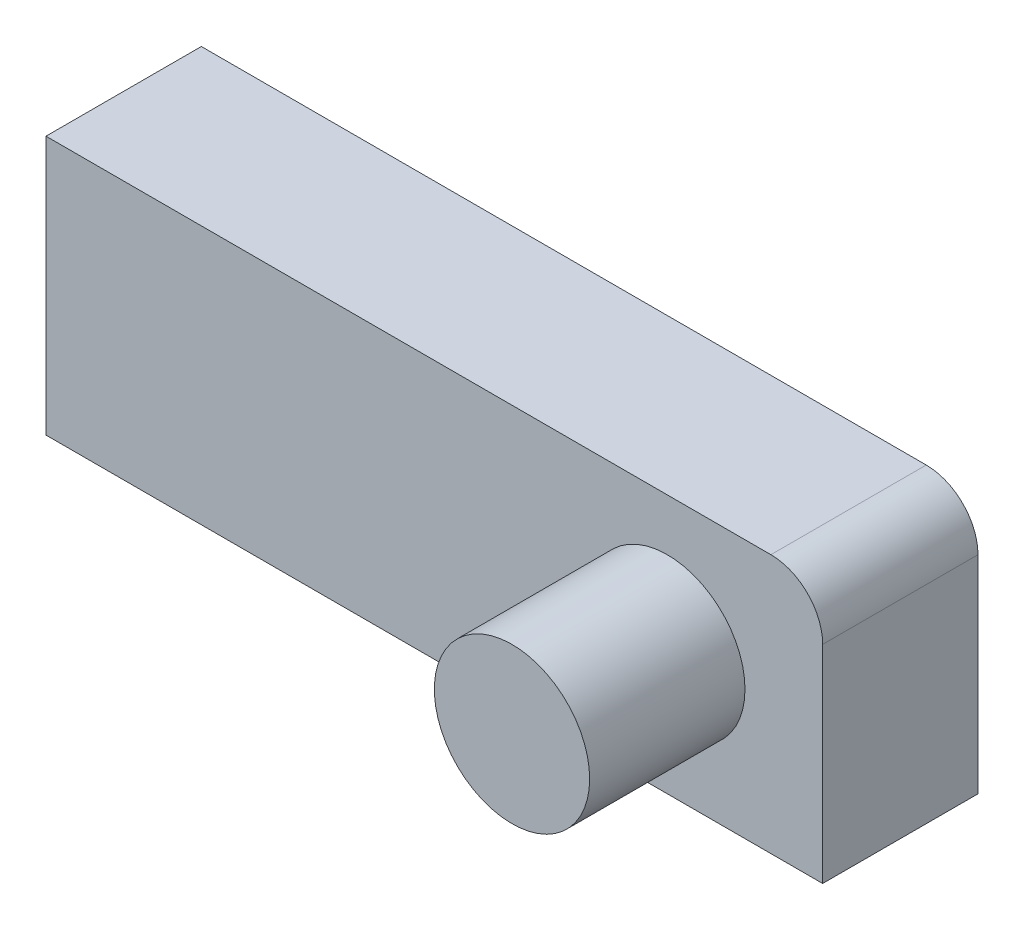
from build123d import *

# Parameters (mm, degrees)
SKETCH_1_W      = 15
SKETCH_1_H      = 5
EXTRUDE_1_DEPTH = 3
SKETCH_2_R      = 1.5
EXTRUDE_2_DEPTH = 3
FILLET_2_R      = 1


with BuildPart() as part:
    # 草图1 → 凸台-拉伸1 (new body)
    with BuildSketch(Plane.XY):
        with Locations((-9.275700935, 1.740654206)):
            Rectangle(SKETCH_1_W, SKETCH_1_H)
    extrude(amount=EXTRUDE_1_DEPTH)

    # 草图2 → 凸台-拉伸2 (add)
    with BuildSketch(Plane.XY.offset(3)):
        with Locations((-4.775700935, 1.740654206)):
            Circle(SKETCH_2_R)
    extrude(amount=EXTRUDE_2_DEPTH)

    # 圆角2
    fillet_2_edges = [part.edges().sort_by_distance(p)[0] for p in [
        (-1.775700935, 4.240654206, 1.5),
    ]]
    fillet(fillet_2_edges, radius=FILLET_2_R)


solid = part.part
